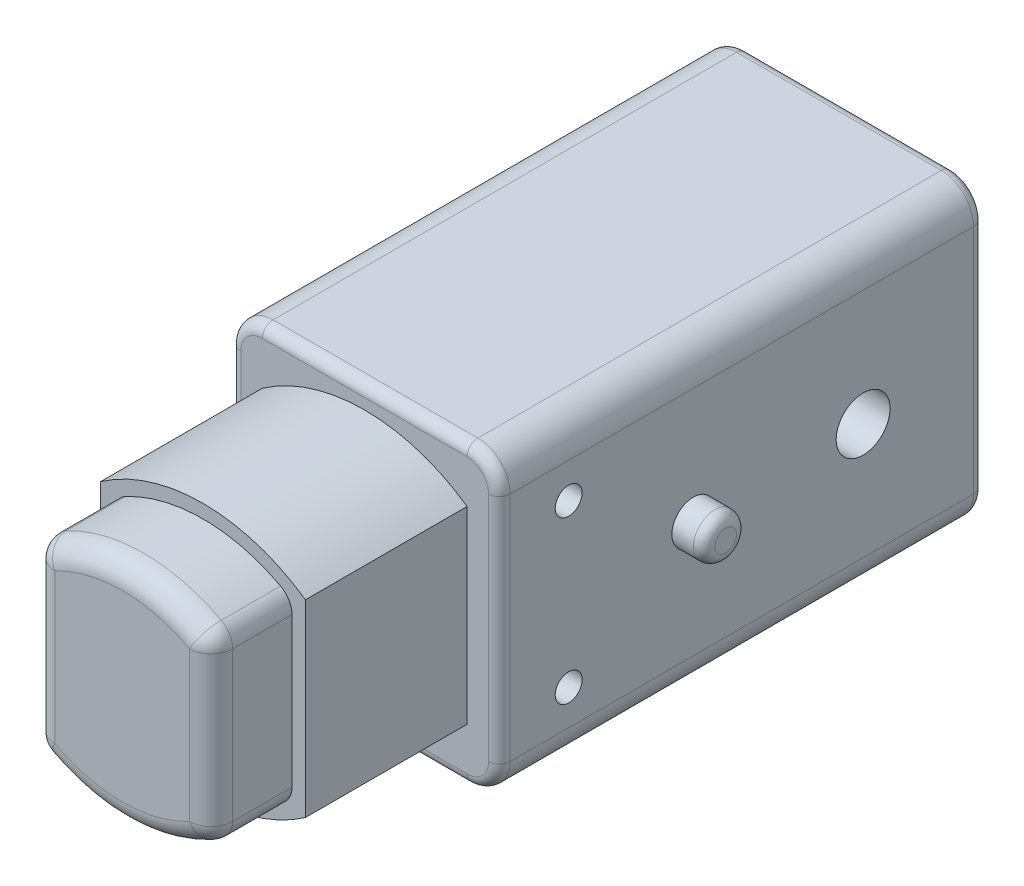
from build123d import *

# Parameters (mm, degrees)
MOTORBODY1_DEPTH            = 45
MOTORBODY2_DEPTH            = 15
SIDE_ENGRAVEMENT_SKETCH_R   = 1.25
SIDE_ENGRAVEMENT_SKETCH_R_2 = 2.5
CUT_EXTRUDE1_DEPTH          = 67.43841133
SIDE_ENGRAVEMENT_SKETCH_3_R = 2
BOSS_EXTRUDE3_DEPTH         = 3
SKETCH4_R                   = 3.5
BOSS_EXTRUDE5_DEPTH         = 5
FILLET1_R                   = 1
BOSS_EXTRUDE6_DEPTH         = 7.5
FILLET3_R                   = 2


with BuildPart() as part:
    # MotorMainSketch → MotorBody1 (new body)
    with BuildSketch(Plane.XY):
        with BuildLine():
            Line((-9.5, 13.75), (9.5, 13.75))
            ThreePointArc((9.5, 13.75), (11.621320344, 12.871320344), (12.5, 10.75))
            Line((12.5, 10.75), (12.5, -10.75))
            ThreePointArc((12.5, -10.75), (11.621320344, -12.871320344), (9.5, -13.75))
            Line((9.5, -13.75), (-9.5, -13.75))
            ThreePointArc((-9.5, -13.75), (-11.621320344, -12.871320344), (-12.5, -10.75))
            Line((-12.5, -10.75), (-12.5, 10.75))
            ThreePointArc((-12.5, 10.75), (-11.621320344, 12.871320344), (-9.5, 13.75))
        make_face()
    extrude(amount=MOTORBODY1_DEPTH)

    # side engravement sketch → Cut-Extrude1 (cut, through all)
    with BuildSketch(Plane(origin=(12.5, 0, 0), x_dir=(0, 0, -1), z_dir=(1, 0, 0))):
        with Locations((-38.571428571, 7.5)):
            Circle(SIDE_ENGRAVEMENT_SKETCH_R)
        with Locations((-38.571428571, -7.5)):
            Circle(SIDE_ENGRAVEMENT_SKETCH_R)
        with Locations((-11.25, 0)):
            Circle(SIDE_ENGRAVEMENT_SKETCH_R_2)
    extrude(amount=-CUT_EXTRUDE1_DEPTH, mode=Mode.SUBTRACT)

    # side engravement sketch<3> → Boss-Extrude3 (add)
    with BuildSketch(Plane(origin=(12.5, 0, 0), x_dir=(0, 0, -1), z_dir=(1, 0, 0))):
        with Locations((-27, 0)):
            Circle(SIDE_ENGRAVEMENT_SKETCH_3_R)
    extrude(amount=BOSS_EXTRUDE3_DEPTH)

    # Sketch4 → Boss-Extrude5 (add)
    with BuildSketch(Plane(origin=(0, 0, 0), x_dir=(-1, 0, 0), z_dir=(0, 0, -1))):
        Circle(SKETCH4_R)
    extrude(amount=BOSS_EXTRUDE5_DEPTH)

    # Fillet1
    fillet1_edges = [part.edges().sort_by_distance(p)[0] for p in [
        (11.621320344, -12.871320344, 45),
        (0, -13.75, 45),
        (-11.621320344, -12.871320344, 45),
        (-12.5, 0, 45),
        (-11.621320344, 12.871320344, 45),
        (0, 13.75, 45),
        (11.621320344, 12.871320344, 45),
        (11.621320344, 12.871320344, 0),
        (12.5, 0, 0),
        (11.621320344, -12.871320344, 0),
        (0, -13.75, 0),
        (-11.621320344, -12.871320344, 0),
        (-12.5, 0, 0),
        (-11.621320344, 12.871320344, 0),
        (12.5, 0, 45),
        (15.5, 0, 29),
        (3.5, 0, -5),
        (0, 13.75, 0),
    ]]
    fillet(fillet1_edges, radius=FILLET1_R)


with BuildPart() as body_2:
    # Motorsketch → MotorBody2 (new body)
    with BuildSketch(Plane.XY.offset(45)):
        with BuildLine():
            Line((-9.5, 8.75), (-9.5, -8.75))
            ThreePointArc((-9.5, -8.75), (0, -11.75), (9.5, -8.75))
            Line((9.5, -8.75), (9.5, 8.75))
            ThreePointArc((9.5, 8.75), (0, 11.75), (-9.5, 8.75))
        make_face()
    extrude(amount=MOTORBODY2_DEPTH)

    # Sketch5 → Boss-Extrude6 (add)
    with BuildSketch(Plane.XY.offset(60)):
        with BuildLine():
            ThreePointArc((8.25, 8.083603018), (0, 10.5), (-8.25, 8.083603018))
            Line((-8.25, 8.083603018), (-8.25, -8.083603018))
            ThreePointArc((-8.25, -8.083603018), (0, -10.5), (8.25, -8.083603018))
            Line((8.25, -8.083603018), (8.25, 8.083603018))
        make_face()
    extrude(amount=BOSS_EXTRUDE6_DEPTH)

    # Fillet3
    fillet3_edges = [body_2.edges().sort_by_distance(p)[0] for p in [
        (8.25, -8.083603018, 63.75),
        (0, -10.5, 67.5),
        (-8.25, -8.083603018, 63.75),
        (-8.25, 0, 67.5),
        (-8.25, 8.083603018, 63.75),
        (0, 10.5, 67.5),
        (8.25, 0, 67.5),
        (8.25, 8.083603018, 63.75),
    ]]
    fillet(fillet3_edges, radius=FILLET3_R)


solid = Compound([part.part, body_2.part])
